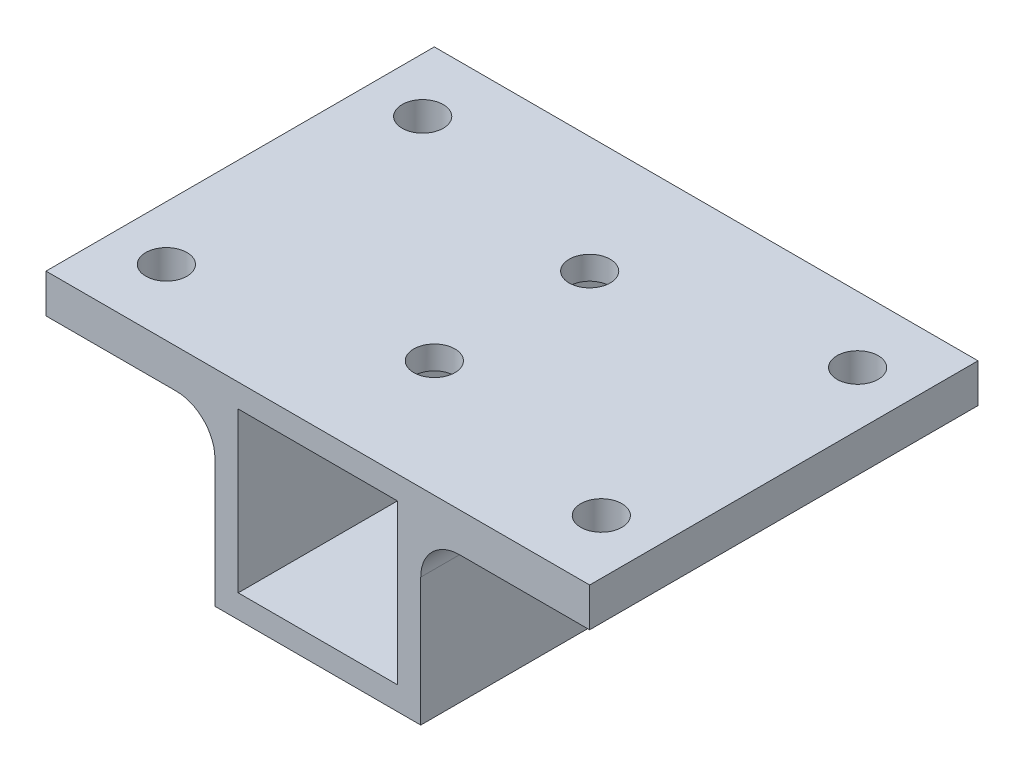
from build123d import *

# Parameters (mm, degrees)
SKETCH_1_W          = 26.5
SKETCH_1_H          = 26.5
SKETCH_1_W_2        = 20.5
SKETCH_1_H_2        = 20.5
EXTRUDE_3_DEPTH     = 50
SKETCH_2_R          = 2.65
SKETCH_2_W          = 21.75
SKETCH_2_H          = 50
EXTRUDE_4_DEPTH     = 5
CUT_EXTRUDE_1_DEPTH = 67.537583365
SKETCH_4_R          = 2.65
CUT_EXTRUDE_2_DEPTH = 71.736306095
FILLET_1_R          = 5


with BuildPart() as part:
    # 草图1 → 凸台-拉伸3 (new body)
    with BuildSketch(Plane.XY):
        Rectangle(SKETCH_1_W, SKETCH_1_H)
        Rectangle(SKETCH_1_W_2, SKETCH_1_H_2, mode=Mode.SUBTRACT)
    extrude(amount=EXTRUDE_3_DEPTH)

    # 草图2 → 凸台-拉伸4 (add)
    # profile 1 of 2: a face of its own
    with BuildSketch(Plane(origin=(0, 13.25, 0), x_dir=(1, 0, 0), z_dir=(0, 1, 0))):
        Polygon((-13.25, -50), (-13.25, -25), (-13.25, 0), (-35, 0), (-35, -50), align=None)
        with Locations(Location((-28, -41.5, 0), (0, 0, 270))):
            Circle(SKETCH_2_R, mode=Mode.SUBTRACT)
        with Locations(Location((-28, -8.5, 0), (0, 0, 270))):
            Circle(SKETCH_2_R, mode=Mode.SUBTRACT)
    # profile 2 of 2: a face of its own
    with BuildSketch(Plane(origin=(0, 13.25, 0), x_dir=(1, 0, 0), z_dir=(0, 1, 0))):
        with Locations((24.125, -25)):
            Rectangle(SKETCH_2_W, SKETCH_2_H)
        with Locations(Location((28, -41.5, 0), (0, 0, 270))):
            Circle(SKETCH_2_R, mode=Mode.SUBTRACT)
        with Locations(Location((28, -8.5, 0), (0, 0, 270))):
            Circle(SKETCH_2_R, mode=Mode.SUBTRACT)
    extrude(amount=-EXTRUDE_4_DEPTH)

    # 草图3 → 切除-拉伸1 (cut, through all)
    with BuildSketch(Plane(origin=(0, 13.25, 0), x_dir=(1, 0, 0), z_dir=(0, 1, 0))):
        with BuildLine():
            ThreePointArc((2.65, -15), (1.87383297, -13.12616703), (0, -12.35))
            Line((0, -12.35), (0, -17.65))
            ThreePointArc((0, -17.65), (1.87383297, -16.87383297), (2.65, -15))
        make_face()
        with BuildLine():
            Line((0, -17.65), (0, -12.35))
            ThreePointArc((0, -12.35), (-2.65, -15), (0, -17.65))
        make_face()
        with BuildLine():
            ThreePointArc((2.65, -35), (1.87383297, -33.12616703), (0, -32.35))
            Line((0, -32.35), (0, -37.65))
            ThreePointArc((0, -37.65), (1.87383297, -36.87383297), (2.65, -35))
        make_face()
        with BuildLine():
            Line((0, -37.65), (0, -32.35))
            ThreePointArc((0, -32.35), (-2.65, -35), (0, -37.65))
        make_face()
    extrude(amount=-CUT_EXTRUDE_1_DEPTH, mode=Mode.SUBTRACT)

    # 草图4 → 切除-拉伸2 (cut, through all)
    with BuildSketch(Plane.ZY.offset(13.25)):
        with Locations((15, 0)):
            Circle(SKETCH_4_R)
        with Locations((35, 0)):
            Circle(SKETCH_4_R)
    extrude(amount=-CUT_EXTRUDE_2_DEPTH, mode=Mode.SUBTRACT)

    # 圆角1
    fillet_1_edges = [part.edges().sort_by_distance(p)[0] for p in [
        (-13.25, 8.25, 25),
        (13.25, 8.25, 25),
    ]]
    fillet(fillet_1_edges, radius=FILLET_1_R)


solid = part.part
